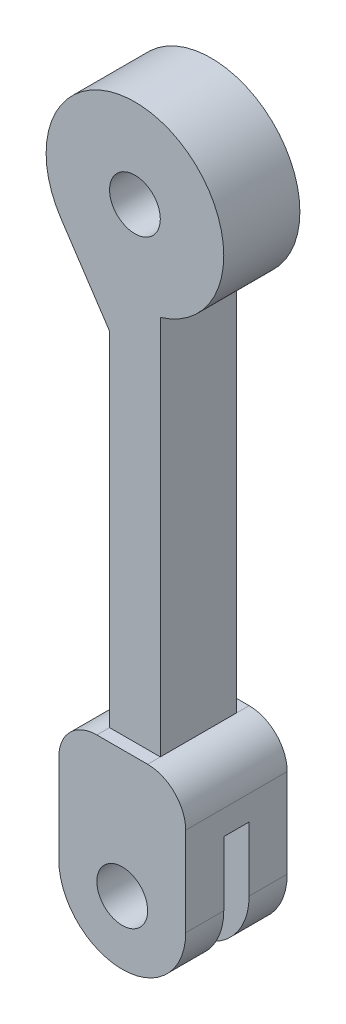
from build123d import *

# Parameters (mm, degrees)
SKETCH1_R                = 1
BOSS_EXTRUDE1_DEPTH      = 4
BOSS_EXTRUDE2_DEPTH      = 1.5
BOSS_EXTRUDE2_DEPTH_BACK = 1.5
BOSS_EXTRUDE2_START      = 2
SKETCH2_R                = 1
SKETCH3_W                = 1
SKETCH3_H                = 6.076691854
CUT_EXTRUDE1_DEPTH       = 10


with BuildPart() as part:
    # Sketch1 → Boss-Extrude1 (new body)
    with BuildSketch(Plane.XY):
        with BuildLine():
            Line((-2.5, 0), (-2.5, 3.5))
            ThreePointArc((-2.5, 3.5), (-2.060660172, 4.560660172), (-1, 5))
            Line((-1, 5), (1, 5))
            ThreePointArc((1, 5), (2.060660172, 4.560660172), (2.5, 3.5))
            Line((2.5, 3.5), (2.5, 0))
            ThreePointArc((2.5, 0), (0, -2.5), (-2.5, 0))
        make_face()
        Circle(SKETCH1_R, mode=Mode.SUBTRACT)
    extrude(amount=BOSS_EXTRUDE1_DEPTH)

    # Sketch2 → Boss-Extrude2 (add, two sides: drawn at the far end of the back side and taken through both)
    with BuildSketch(Plane.XY.offset(BOSS_EXTRUDE2_START - BOSS_EXTRUDE2_DEPTH_BACK)):
        with BuildLine():
            Line((1, 5), (1, 20))
            ThreePointArc((1, 20), (1.192761143, 26.644591422), (-2.91696209, 21.419849613))
            Line((-2.91696209, 21.419849613), (-1, 18.528962219))
            Line((-1, 18.528962219), (-1, 5))
            Line((-1, 5), (1, 5))
        make_face()
        with Locations((0, 23.354101966)):
            Circle(SKETCH2_R, mode=Mode.SUBTRACT)
    extrude(amount=BOSS_EXTRUDE2_DEPTH + BOSS_EXTRUDE2_DEPTH_BACK)

    # Sketch3 → Cut-Extrude1 (cut)
    with BuildSketch(Plane(origin=(2.5, 0, 0), x_dir=(0, 0, -1), z_dir=(1, 0, 0))):
        with Locations((-2, -0.507860796)):
            Rectangle(SKETCH3_W, SKETCH3_H)
    extrude(amount=-CUT_EXTRUDE1_DEPTH, mode=Mode.SUBTRACT)


solid = part.part
